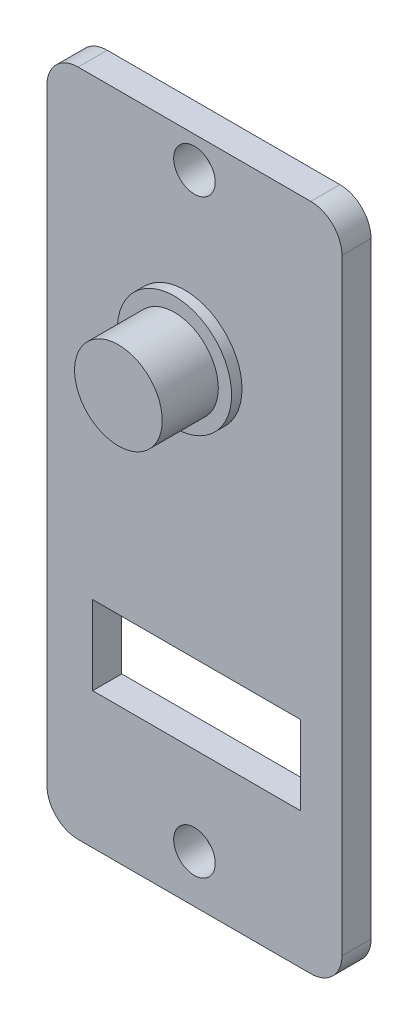
from build123d import *

# Parameters (mm, degrees)
SKETCH1_W           = 14.2
SKETCH1_H           = 32.2
BOSS_EXTRUDE1_DEPTH = 1.4
SKETCH2_R           = 1
SKETCH2_W           = 10
SKETCH2_H           = 3.8
CUT_EXTRUDE1_DEPTH  = 1.4
SKETCH3_R           = 2.11
BOSS_EXTRUDE2_DEPTH = 3.2
FILLET1_R           = 1.5
SKETCH5_R           = 2.75
BOSS_EXTRUDE3_DEPTH = 0.5


with BuildPart() as part:
    # Sketch1 → Boss-Extrude1 (new body)
    with BuildSketch(Plane.XY.offset(5)):
        with Locations((-99.59415338, 219.653192448)):
            Rectangle(SKETCH1_W, SKETCH1_H)
    extrude(amount=BOSS_EXTRUDE1_DEPTH)

    # Sketch2 → Cut-Extrude1 (cut)
    with BuildSketch(Plane.XY.offset(6.4)):
        with Locations((-99.59415338, 234.253192448)):
            Circle(SKETCH2_R)
        with Locations((-99.59415338, 205.853192448)):
            Circle(SKETCH2_R)
        with Locations((-99.49415338, 212.003192448)):
            Rectangle(SKETCH2_W, SKETCH2_H)
    extrude(amount=-CUT_EXTRUDE1_DEPTH, mode=Mode.SUBTRACT)

    # Sketch3 → Boss-Extrude2 (add)
    with BuildSketch(Plane.XY.offset(6.4)):
        with Locations((-100.055672153, 226.235056066)):
            Circle(SKETCH3_R)
    extrude(amount=BOSS_EXTRUDE2_DEPTH)

    # Fillet1
    fillet1_edges = [part.edges().sort_by_distance(p)[0] for p in [
        (-106.69415338, 235.753192448, 5.7),
        (-92.49415338, 235.753192448, 5.7),
        (-92.49415338, 203.553192448, 5.7),
        (-106.69415338, 203.553192448, 5.7),
    ]]
    fillet(fillet1_edges, radius=FILLET1_R)

    # Sketch5 → Boss-Extrude3 (add)
    with BuildSketch(Plane.XY.offset(6.4)):
        with Locations((-100.056084646, 226.274312916)):
            Circle(SKETCH5_R)
    extrude(amount=BOSS_EXTRUDE3_DEPTH)


solid = part.part
